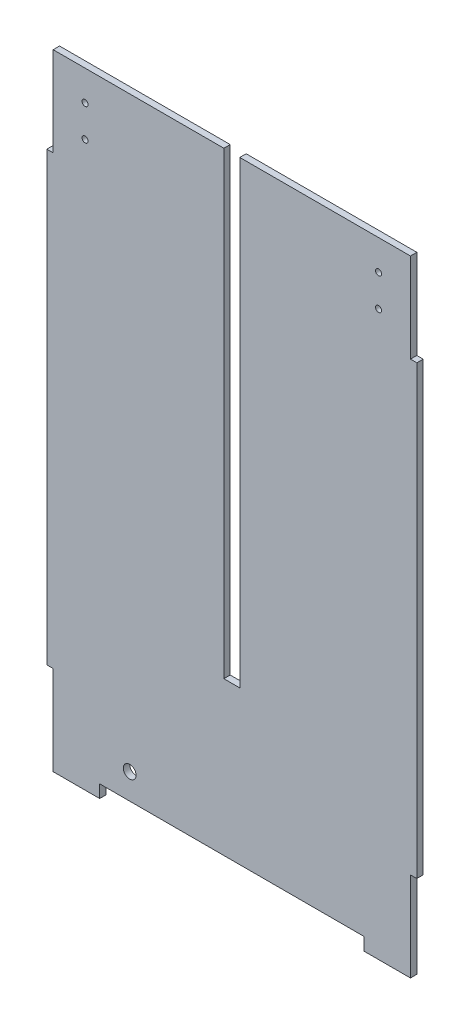
from build123d import *

# Parameters (mm, degrees)
SKETCH2_W           = 3.175
SKETCH2_H           = 44.45
SKETCH2_W_2         = 23.132142857
SKETCH2_H_2         = 6.35
SKETCH2_W_3         = 26.307142857
BOSS_EXTRUDE1_DEPTH = 3.175
SKETCH3_W           = 7.9375
SKETCH3_H           = 228.6
CUT_EXTRUDE1_DEPTH  = 184.546857096
SKETCH4_R           = 3.175
CUT_EXTRUDE2_DEPTH  = 184.546857096
SKETCH5_R           = 1.5
CUT_EXTRUDE3_DEPTH  = 3.175
SKETCH6_W           = 3.175
SKETCH6_H           = 44.45
BOSS_EXTRUDE2_DEPTH = 3.175
SKETCH7_W           = 26.307142857
SKETCH7_H           = 6.35
CUT_EXTRUDE4_DEPTH  = 3.175


with BuildPart() as part:
    # Sketch2 → Boss-Extrude1 (new body)
    with BuildSketch(Plane.XY):
        Polygon((0, -152.4), (0, 152.4), (-88.9, 152.4), (-88.9, 107.95), (-88.9, 63.5), (-88.9, 19.05), (-88.9, -25.4), (-88.9, -69.85), (-88.9, -114.3), (-88.9, -152.4), (-65.767857143, -152.4), (-39.460714286, -152.4), (-13.153571429, -152.4), align=None)
        Polygon((88.9, 152.4), (0, 152.4), (0, -152.4), (13.153571429, -152.4), (39.460714286, -152.4), (65.767857143, -152.4), (88.9, -152.4), (88.9, -114.3), (88.9, -69.85), (88.9, -25.4), (88.9, 19.05), (88.9, 63.5), (88.9, 107.95), align=None)
        with Locations((-90.4875, 85.725)):
            Rectangle(SKETCH2_W, SKETCH2_H)
        with Locations((-90.4875, -3.175)):
            Rectangle(SKETCH2_W, SKETCH2_H)
        with Locations((-90.4875, -92.075)):
            Rectangle(SKETCH2_W, SKETCH2_H)
        with Locations((-77.333928571, -155.575)):
            Rectangle(SKETCH2_W_2, SKETCH2_H_2)
        with Locations((-26.307142858, -155.575)):
            Rectangle(SKETCH2_W_3, SKETCH2_H_2)
        with Locations((26.307142858, -155.575)):
            Rectangle(SKETCH2_W_3, SKETCH2_H_2)
        with Locations((90.4875, -92.075)):
            Rectangle(SKETCH2_W, SKETCH2_H)
        with Locations((90.4875, -3.175)):
            Rectangle(SKETCH2_W, SKETCH2_H)
        with Locations((90.4875, 85.725)):
            Rectangle(SKETCH2_W, SKETCH2_H)
        with Locations((77.333928571, -155.575)):
            Rectangle(SKETCH2_W_2, SKETCH2_H_2)
    extrude(amount=BOSS_EXTRUDE1_DEPTH)

    # Sketch3 → Cut-Extrude1 (cut, through all)
    with BuildSketch(Plane.XY.offset(3.175)):
        with Locations((0, 38.1)):
            Rectangle(SKETCH3_W, SKETCH3_H)
    extrude(amount=-CUT_EXTRUDE1_DEPTH, mode=Mode.SUBTRACT)

    # Sketch4 → Cut-Extrude2 (cut, through all)
    with BuildSketch(Plane.XY.offset(3.175)):
        with Locations((-50.8, -139.7)):
            Circle(SKETCH4_R)
    extrude(amount=-CUT_EXTRUDE2_DEPTH, mode=Mode.SUBTRACT)

    # Sketch5 → Cut-Extrude3 (cut)
    with BuildSketch(Plane.XY.offset(3.175)):
        with Locations((-73.025, 137.4)):
            Circle(SKETCH5_R)
        with Locations((-73.025, 121.65)):
            Circle(SKETCH5_R)
        with Locations((73.025, 121.65)):
            Circle(SKETCH5_R)
        with Locations((73.025, 137.4)):
            Circle(SKETCH5_R)
    extrude(amount=-CUT_EXTRUDE3_DEPTH, mode=Mode.SUBTRACT)

    # Sketch6 → Boss-Extrude2 (add)
    with BuildSketch(Plane.XY.offset(3.175)):
        with Locations((-90.4875, 41.275)):
            Rectangle(SKETCH6_W, SKETCH6_H)
        with Locations((-90.4875, -47.625)):
            Rectangle(SKETCH6_W, SKETCH6_H)
        with Locations((90.4875, 41.275)):
            Rectangle(SKETCH6_W, SKETCH6_H)
        with Locations((90.4875, -47.625)):
            Rectangle(SKETCH6_W, SKETCH6_H)
    extrude(amount=-BOSS_EXTRUDE2_DEPTH)

    # Sketch7 → Cut-Extrude4 (cut)
    with BuildSketch(Plane.XY.offset(3.175)):
        with Locations((-26.307142858, -155.575)):
            Rectangle(SKETCH7_W, SKETCH7_H)
        with Locations((26.307142858, -155.575)):
            Rectangle(SKETCH7_W, SKETCH7_H)
    extrude(amount=-CUT_EXTRUDE4_DEPTH, mode=Mode.SUBTRACT)


solid = part.part
